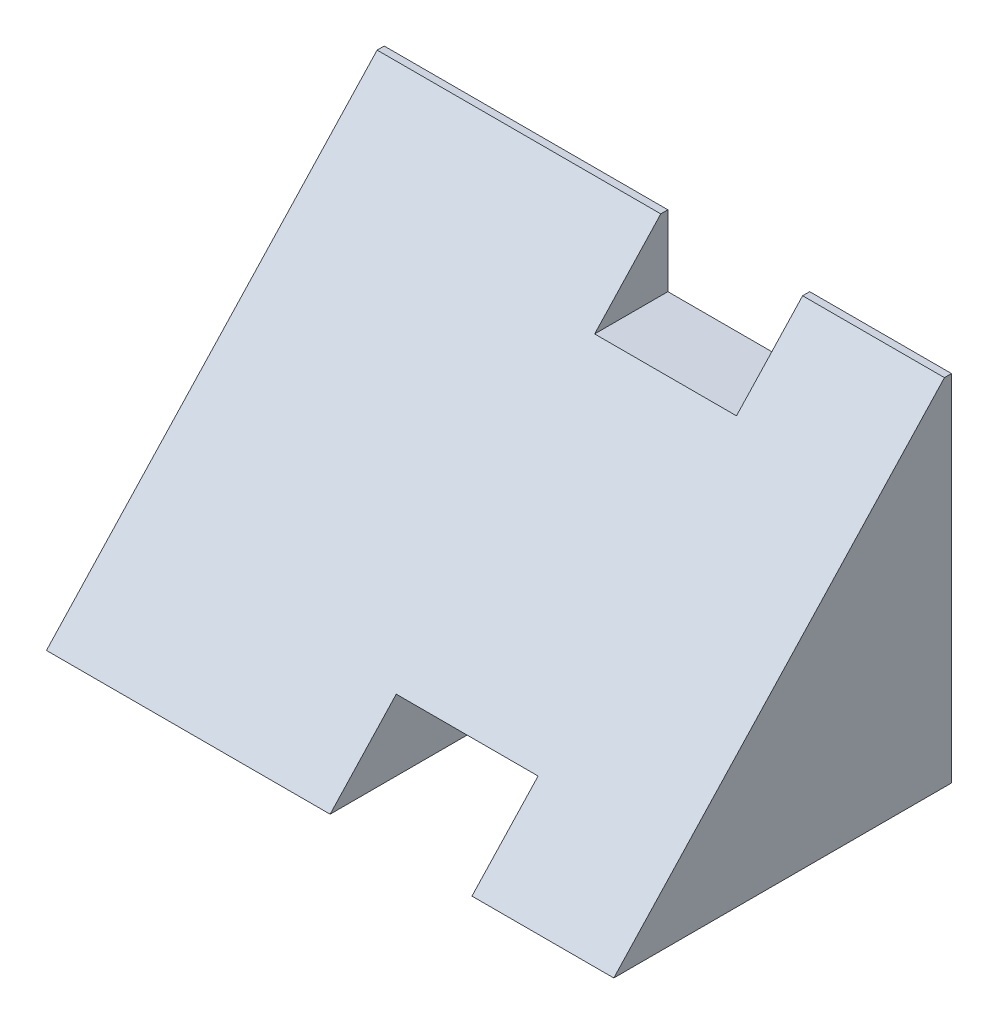
from build123d import *

# Parameters (mm, degrees)
EXTRUDE_1_DEPTH = 1
DRAFT_5_ANGLE   = 43


with BuildPart() as part:
    # 草图1 → 凸台-拉伸1 (new body)
    with BuildSketch(Plane.XY):
        Polygon((-9.644281244, 0), (30.355718756, 0), (30.355718756, -10), (50.355718756, -10), (50.355718756, 0), (70.355718756, 0), (70.355718756, -50), (50.355718756, -50), (50.355718756, -40), (30.355718756, -40), (30.355718756, -50), (-9.644281244, -50), align=None)
    extrude(amount=EXTRUDE_1_DEPTH)

    # 拔模5
    draft_5_faces = [part.faces().sort_by_distance(p)[0] for p in [
        (29.244607645, -25, 1),
    ]]
    draft(draft_5_faces, Plane(origin=(-9.644281244, 0, 1), x_dir=(1, 0, 0), z_dir=(0, 1, 0)), DRAFT_5_ANGLE)


solid = part.part
